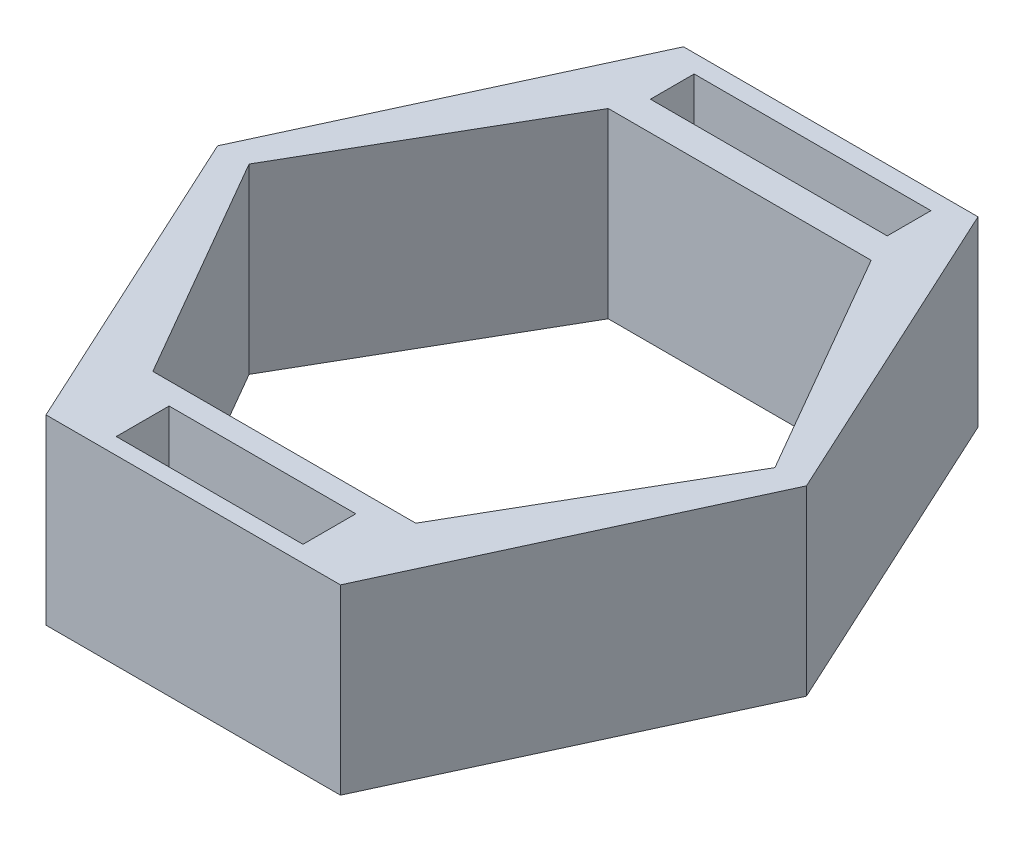
from build123d import *

# Parameters (mm, degrees)
BOSS_EXTRUDE1_DEPTH = 20
SKETCH2_W           = 20.5
SKETCH2_H           = 5.8
CUT_EXTRUDE1_DEPTH  = 17
SKETCH2_3_W         = 26
SKETCH2_3_H         = 4.8
CUT_EXTRUDE2_DEPTH  = 26


with BuildPart() as part:
    # Sketch1 → Boss-Extrude1 (new body)
    with BuildSketch(Plane(origin=(0, 0, 0), x_dir=(1, 0, 0), z_dir=(0, 1, 0))):
        Polygon((16.165807537, -35), (32.331615075, 0), (16.165807537, 35), (-16.165807537, 35), (-32.331615075, 0), (-16.165807537, -35), align=None)
        Polygon((14.43375673, 25), (28.867513459, 0), (14.43375673, -25), (-14.43375673, -25), (-28.867513459, 0), (-14.43375673, 25), align=None, mode=Mode.SUBTRACT)
    extrude(amount=BOSS_EXTRUDE1_DEPTH)

    # Sketch2 → Cut-Extrude1 (cut)
    with BuildSketch(Plane(origin=(0, 20, 0), x_dir=(1, 0, 0), z_dir=(0, 1, 0))):
        with Locations((0, -30.3)):
            Rectangle(SKETCH2_W, SKETCH2_H)
    extrude(amount=-CUT_EXTRUDE1_DEPTH, mode=Mode.SUBTRACT)

    # Sketch2<3> → Cut-Extrude2 (cut)
    with BuildSketch(Plane(origin=(0, 20, 0), x_dir=(1, 0, 0), z_dir=(0, 1, 0))):
        with Locations((0, 30.6)):
            Rectangle(SKETCH2_3_W, SKETCH2_3_H)
    extrude(amount=-CUT_EXTRUDE2_DEPTH, mode=Mode.SUBTRACT)


solid = part.part
